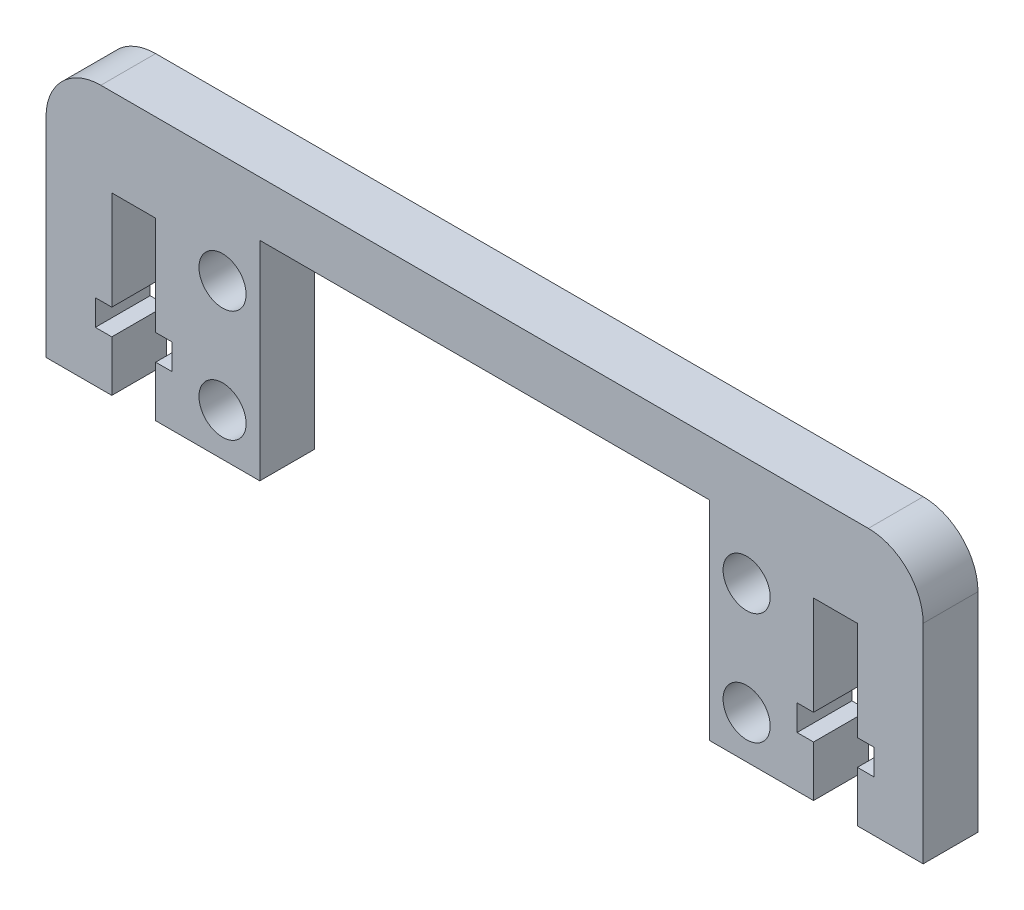
from build123d import *

# Parameters (mm, degrees)
ESQUISSE1_R             = 2.15
BOSS_EXTRU_1_DEPTH      = 5
ENL_V_MAT_EXTRU_2_DEPTH = 30


with BuildPart() as part:
    # Esquisse1 → Boss.-Extru.1 (new body)
    with BuildSketch(Plane.XY):
        with BuildLine():
            Line((-19.5, 0), (0, 0))
            Line((0, 0), (0, 19))
            Line((0, 19), (41, 19))
            Line((41, 19), (41, 0))
            Line((41, 0), (60.5, 0))
            Line((60.5, 0), (60.5, 19))
            ThreePointArc((60.5, 19), (59.035533906, 22.535533906), (55.5, 24))
            Line((55.5, 24), (-14.5, 24))
            ThreePointArc((-14.5, 24), (-18.035533906, 22.535533906), (-19.5, 19))
            Line((-19.5, 19), (-19.5, 0))
        make_face()
        with Locations((44.4, 14.1)):
            Circle(ESQUISSE1_R, mode=Mode.SUBTRACT)
        with Locations((44.4, 3.9)):
            Circle(ESQUISSE1_R, mode=Mode.SUBTRACT)
        with Locations((-3.4, 14.1)):
            Circle(ESQUISSE1_R, mode=Mode.SUBTRACT)
        with Locations((-3.4, 3.9)):
            Circle(ESQUISSE1_R, mode=Mode.SUBTRACT)
    extrude(amount=BOSS_EXTRU_1_DEPTH)

    # Esquisse3 → Enlèv. mat.-Extru.2 (cut)
    with BuildSketch(Plane.XY.offset(5)):
        Polygon((-9.5, 3.002605055), (-9.5, 4.625752713), (-8, 4.625752713), (-8, 6.971671519), (-9.5, 6.971671519), (-9.5, 16), (-13.5, 16), (-13.5, 6.971671519), (-15, 6.971671519), (-15, 4.625752713), (-13.5, 4.625752713), (-13.5, 3.002605055), (-13.5, 0), (-9.5, 0), align=None)
        Polygon((54.5, 0), (50.5, 0), (50.5, 3.002605055), (50.5, 4.625752713), (49, 4.625752713), (49, 6.971671519), (50.5, 6.971671519), (50.5, 16), (54.5, 16), (54.5, 6.971671519), (56, 6.971671519), (56, 4.625752713), (54.5, 4.625752713), (54.5, 3.002605055), align=None)
    extrude(amount=-ENL_V_MAT_EXTRU_2_DEPTH, mode=Mode.SUBTRACT)


solid = part.part
